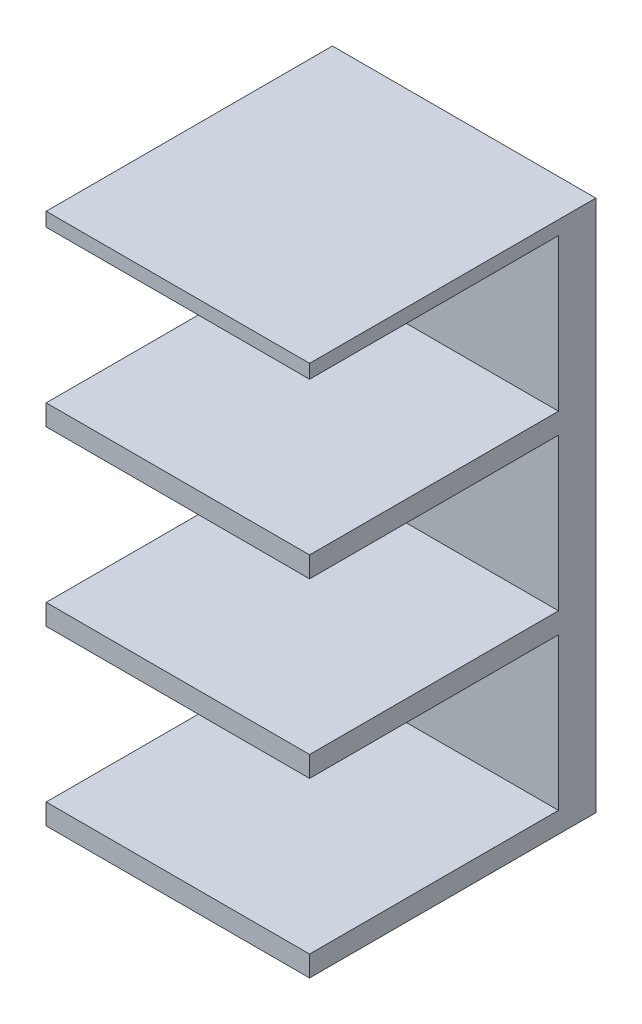
from build123d import *

# Parameters (mm, degrees)
SKETCH_1_W          = 1750
SKETCH_1_H          = 1800
EXTRUDE_3_DEPTH     = 150
SKETCH_2_W          = 1750
SKETCH_2_H          = 1800
EXTRUDE_5_DEPTH     = 150
SKETCH_3_W          = 1750
SKETCH_3_H          = 1800
EXTRUDE_6_DEPTH     = 150
SKETCH_7_W          = 1750
SKETCH_7_H          = 1800
EXTRUDE_10_DEPTH    = 100
SKETCH_4_W          = 1750
SKETCH_4_H          = 270
EXTRUDE_11_DEPTH    = 3700
SKETCH_8_W          = 1750
SKETCH_8_H          = 3550
CUT_EXTRUDE_1_DEPTH = 7400
EXTRUDE_13_DEPTH    = 1030


with BuildPart() as part:
    # 草图1 → 凸台-拉伸3 (new body)
    with BuildSketch(Plane(origin=(0, 0, 0), x_dir=(1, 0, 0), z_dir=(0, 1, 0))):
        Rectangle(SKETCH_1_W, SKETCH_1_H)
    extrude(amount=-EXTRUDE_3_DEPTH)



with BuildPart() as body_2:
    # 草图2 → 凸台-拉伸5 (new body)
    with BuildSketch(Plane(origin=(0, 1250, 0), x_dir=(1, 0, 0), z_dir=(0, 1, 0))):
        Rectangle(SKETCH_2_W, SKETCH_2_H)
    extrude(amount=-EXTRUDE_5_DEPTH)


with BuildPart() as body_3:
    # 草图3 → 凸台-拉伸6 (new body)
    with BuildSketch(Plane(origin=(0, 2500, 0), x_dir=(1, 0, 0), z_dir=(0, 1, 0))):
        Rectangle(SKETCH_3_W, SKETCH_3_H)
    extrude(amount=-EXTRUDE_6_DEPTH)


with BuildPart() as body_4:
    # 草图7 → 凸台-拉伸10 (new body)
    with BuildSketch(Plane(origin=(0, 3600, 0), x_dir=(1, 0, 0), z_dir=(0, 1, 0))):
        Rectangle(SKETCH_7_W, SKETCH_7_H)
    extrude(amount=EXTRUDE_10_DEPTH)


with BuildPart() as part_1:
    add(part.part)

    add(body_2.part)  # 凸台-拉伸11 merges body 2

    add(body_3.part)  # 凸台-拉伸11 merges body 3

    add(body_4.part)  # 凸台-拉伸11 merges body 4
    # 草图4 → 凸台-拉伸11 (add, symmetric)
    with BuildSketch(Plane(origin=(0, 0, 0), x_dir=(1, 0, 0), z_dir=(0, 1, 0))):
        with Locations((0, 1035)):
            Rectangle(SKETCH_4_W, SKETCH_4_H)
    extrude(amount=EXTRUDE_11_DEPTH, both=True)

    # 草图8 → 切除-拉伸1 (cut)
    with BuildSketch(Plane.XY):
        with Locations((0, -1925)):
            Rectangle(SKETCH_8_W, SKETCH_8_H)
    extrude(amount=-CUT_EXTRUDE_1_DEPTH, mode=Mode.SUBTRACT)

    # 草图9 → 凸台-拉伸13 (add)
    with BuildSketch(Plane(origin=(0, 0, 0), x_dir=(0, 0, -1), z_dir=(1, 0, 0))):
        Polygon((-900, 3700), (1170, 3700), (1170, -150), (-900, -150), (-900, 0), (900, 0), (900, 1100), (-900, 1100), (-900, 1250), (900, 1250), (900, 2350), (-900, 2350), (-900, 2500), (900, 2500), (900, 3600), (-900, 3600), align=None)
    extrude(amount=EXTRUDE_13_DEPTH)


solid = part_1.part
